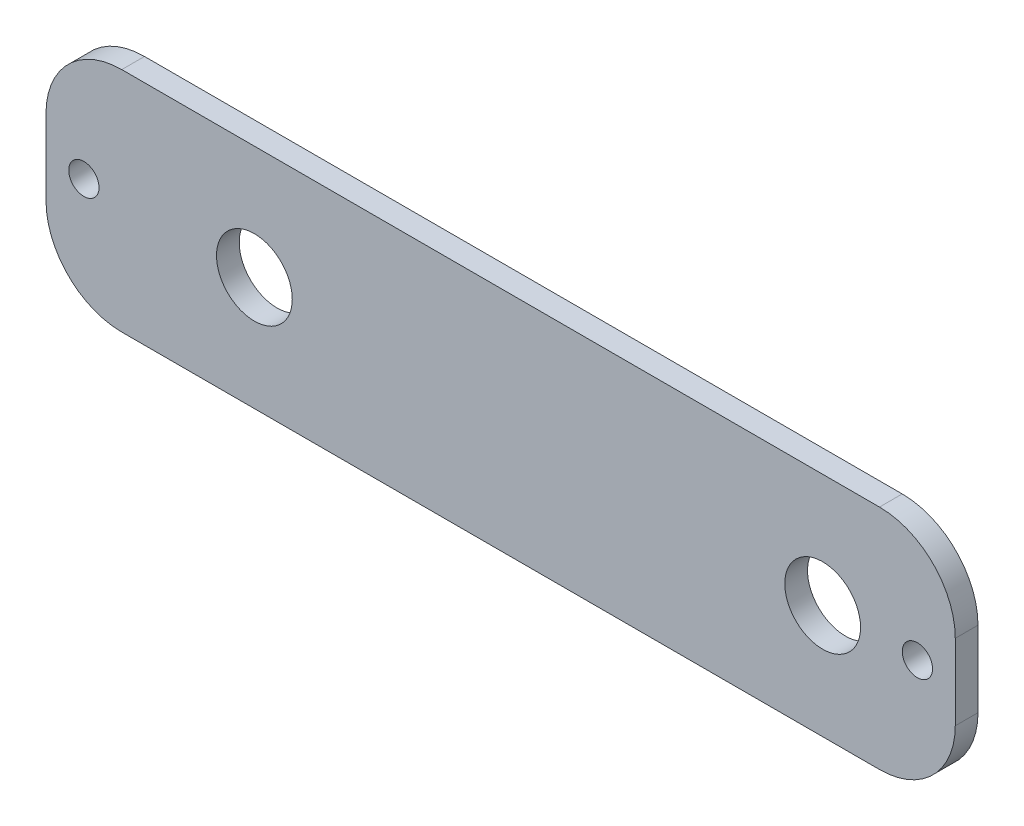
from build123d import *

# Parameters (mm, degrees)
ESQUISSE1_W             = 120
ESQUISSE1_H             = 30
ESQUISSE1_R             = 2
BOSS_EXTRU_1_DEPTH      = 3
CONG_1_R                = 10
ESQUISSE2_R             = 5
ENL_V_MAT_EXTRU_1_DEPTH = 3


with BuildPart() as part:
    # Esquisse1 → Boss.-Extru.1 (new body)
    with BuildSketch(Plane.XY):
        with Locations((60, -15)):
            Rectangle(ESQUISSE1_W, ESQUISSE1_H)
        with Locations((115, -15)):
            Circle(ESQUISSE1_R, mode=Mode.SUBTRACT)
        with Locations((5, -15)):
            Circle(ESQUISSE1_R, mode=Mode.SUBTRACT)
    extrude(amount=BOSS_EXTRU_1_DEPTH)

    # Congé1
    cong_1_edges = [part.edges().sort_by_distance(p)[0] for p in [
        (0, 0, 1.5),
        (120, 0, 1.5),
        (120, -30, 1.5),
        (0, -30, 1.5),
    ]]
    fillet(cong_1_edges, radius=CONG_1_R)

    # Esquisse2 → Enlèv. mat.-Extru.1 (cut)
    with BuildSketch(Plane.XY.offset(3)):
        with Locations((27.5, -15)):
            Circle(ESQUISSE2_R)
        with Locations((102.5, -15)):
            Circle(ESQUISSE2_R)
    extrude(amount=-ENL_V_MAT_EXTRU_1_DEPTH, mode=Mode.SUBTRACT)


solid = part.part
